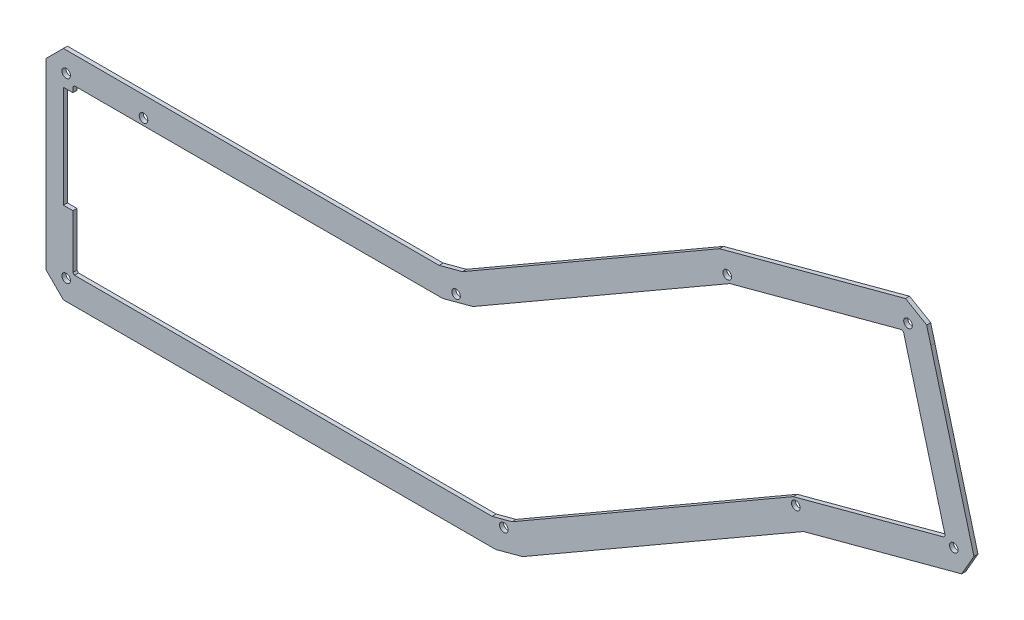
from build123d import *

# Parameters (mm, degrees)
ESQUISSE1_R        = 1.6
BOSS_EXTRU_1_DEPTH = 1.5


with BuildPart() as part:
    # Esquisse1 → Boss.-Extru.1 (new body)
    with BuildSketch(Plane.XY):
        Polygon((-75.988646329, 51.585106383), (42.975455994, 51.585106383), (51.669750275, 53.914735514), (147.250925797, 109.098552931), (210.540810955, 126.057026549), (216.43052053, 127.635169473), (224.324263617, 123.047292559), (225.851989006, 117.211223452), (230.508864659, 99.83152691), (241.906099495, 57.296467436), (237.335031683, 49.379145741), (178.515758799, 33.618569072), (73.963816863, -26.744522748), (63.997857106, -29.414893617), (-96.789296468, -29.414893617), (-103.253762562, -22.950427523), (-103.253762562, 35.79522772), (-103.253762562, 45.120640289), (-96.789296468, 51.585106383), align=None)
        with Locations((-95.753762562, 44.085106383)):
            Circle(ESQUISSE1_R, mode=Mode.SUBTRACT)
        with Locations((-66.988646329, 44.085106383)):
            Circle(ESQUISSE1_R, mode=Mode.SUBTRACT)
        with Locations((-95.753762562, -21.914893617)):
            Circle(ESQUISSE1_R, mode=Mode.SUBTRACT)
        with Locations((67.039694146, -20.835264486)):
            Circle(ESQUISSE1_R, mode=Mode.SUBTRACT)
        with Locations((49.263745973, 45.505477252)):
            Circle(ESQUISSE1_R, mode=Mode.SUBTRACT)
        with Locations((175.637377655, 40.567595866)):
            Circle(ESQUISSE1_R, mode=Mode.SUBTRACT)
        with Locations((150.12930694, 102.149526137)):
            Circle(ESQUISSE1_R, mode=Mode.SUBTRACT)
        with Locations((217.363403759, 120.120565138)):
            Circle(ESQUISSE1_R, mode=Mode.SUBTRACT)
        with Locations((234.393639901, 56.355573542)):
            Circle(ESQUISSE1_R, mode=Mode.SUBTRACT)
        Polygon((-93.253762562, 39.085106383), (-96.753762562, 39.085106383), (-96.753762562, 1.085106383), (-93.253762562, 1.085106383), (-93.253762562, -18.808291899), (-92.647160844, -19.414893617), (62.681332131, -19.414893617), (70.103960937, -17.426006223), (174.655902873, 42.937085598), (230.745845457, 57.966340417), (231.174777645, 58.70927276), (220.849606396, 97.243336459), (216.185262108, 114.650906326), (215.703467251, 116.491412548), (215.001377661, 116.899469991), (213.129001406, 116.397768286), (151.110781723, 99.780036406), (55.529606201, 44.596218989), (44.29198097, 41.585106383), (-75.988646329, 41.585106383), (-92.647160844, 41.585106383), (-93.253762562, 40.978504665), align=None, mode=Mode.SUBTRACT)
    extrude(amount=BOSS_EXTRU_1_DEPTH)


solid = part.part
